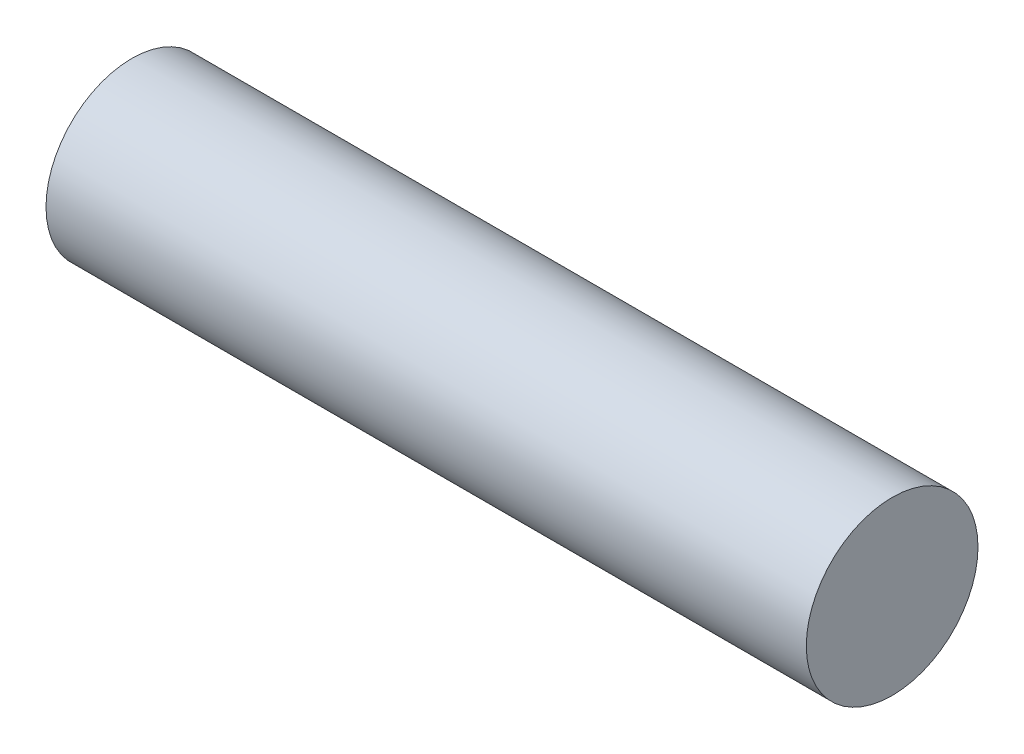
from build123d import *

# Parameters (mm, degrees)
SKETCH1_R           = 1.778
BOSS_EXTRUDE1_DEPTH = 7.874


with BuildPart() as part:
    # Sketch1 → Boss-Extrude1 (new, symmetric)
    with BuildSketch(Plane(origin=(0, 0, 0), x_dir=(0, 0, -1), z_dir=(1, 0, 0))):
        Circle(SKETCH1_R)
    extrude(amount=BOSS_EXTRUDE1_DEPTH, both=True)


solid = part.part
